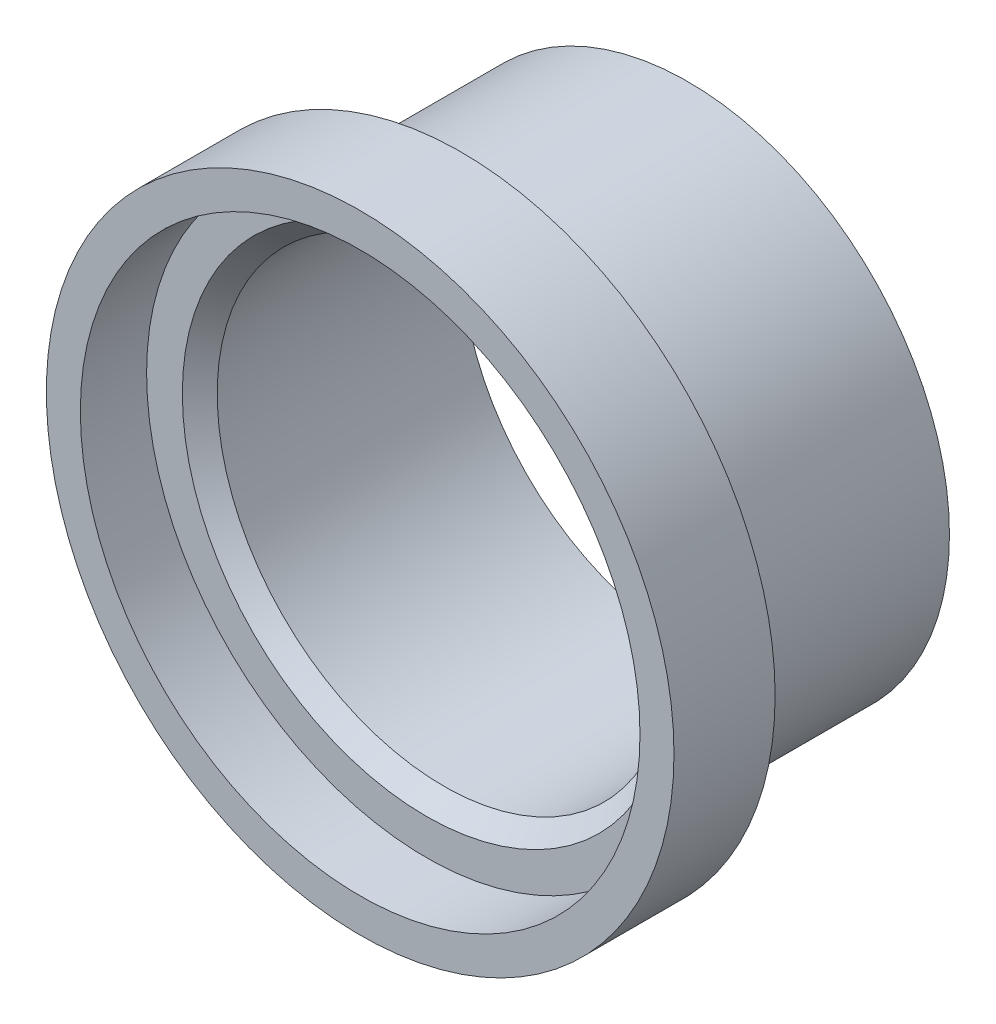
from build123d import *

# Parameters (mm, degrees)
SKETCH1_R           = 15
SKETCH1_R_2         = 13
BOSS_EXTRUDE1_DEPTH = 13
SKETCH2_R           = 18
SKETCH2_R_2         = 13
BOSS_EXTRUDE2_DEPTH = 2
CHAMFER1_SIZE       = 1
SKETCH4_R           = 18
SKETCH4_R_2         = 16.05
BOSS_EXTRUDE3_DEPTH = 3.8


with BuildPart() as part:
    # Sketch1 → Boss-Extrude1 (new body)
    with BuildSketch(Plane.XY):
        Circle(SKETCH1_R)
        Circle(SKETCH1_R_2, mode=Mode.SUBTRACT)
    extrude(amount=BOSS_EXTRUDE1_DEPTH)

    # Sketch2 → Boss-Extrude2 (add)
    with BuildSketch(Plane.XY.offset(13)):
        Circle(SKETCH2_R)
        Circle(SKETCH2_R_2, mode=Mode.SUBTRACT)
    extrude(amount=BOSS_EXTRUDE2_DEPTH)

    # Chamfer1
    chamfer1_edges = [part.edges().sort_by_distance(p)[0] for p in [
        (-13, 0, 15),
    ]]
    chamfer(chamfer1_edges, length=CHAMFER1_SIZE)

    # Sketch4 → Boss-Extrude3 (add)
    with BuildSketch(Plane.XY.offset(15)):
        Circle(SKETCH4_R)
        with Locations(Location((0, 0, 0), (0, 0, 180))):
            Circle(SKETCH4_R_2, mode=Mode.SUBTRACT)
    extrude(amount=BOSS_EXTRUDE3_DEPTH)


solid = part.part
